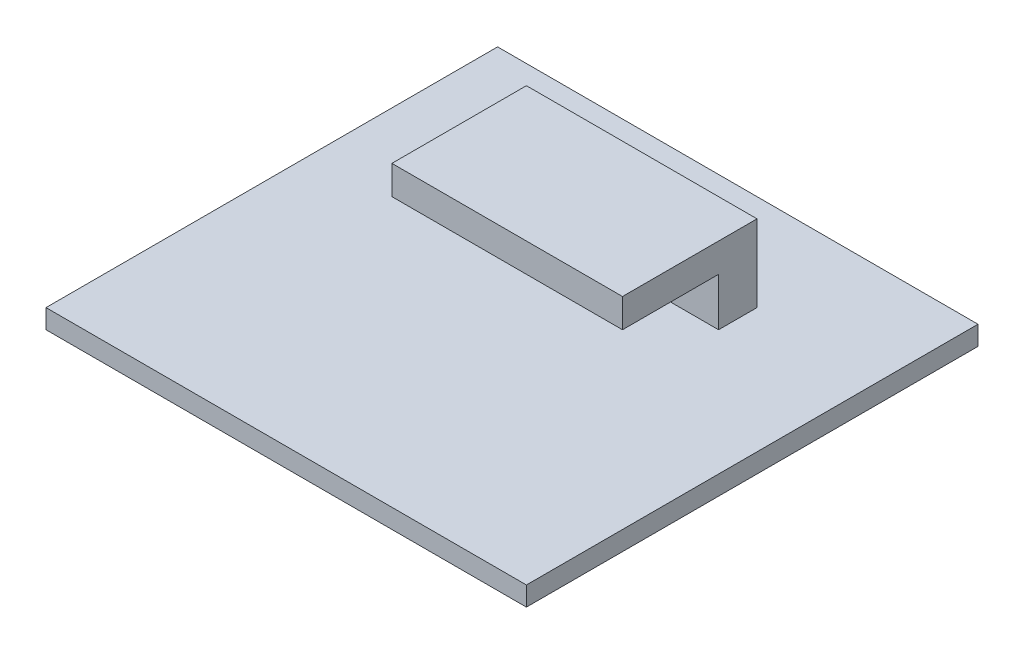
from build123d import *

# Parameters (mm, degrees)
SKETCH_1_W      = 50
SKETCH_1_H      = 47
EXTRUDE_1_DEPTH = 2
EXTRUDE_2_DEPTH = 8
SKETCH_3_W      = 24
SKETCH_3_H      = 3
EXTRUDE_3_DEPTH = 10


with BuildPart() as part:
    # Эскиз1 → Бобышка-Вытянуть1 (new body)
    with BuildSketch(Plane(origin=(0, 0, 0), x_dir=(1, 0, 0), z_dir=(0, 1, 0))):
        with Locations((25, 23.5)):
            Rectangle(SKETCH_1_W, SKETCH_1_H)
    extrude(amount=EXTRUDE_1_DEPTH)

    # Эскиз2 → Бобышка-Вытянуть2 (add)
    with BuildSketch(Plane(origin=(0, 2, 0), x_dir=(1, 0, 0), z_dir=(0, 1, 0))):
        Polygon((25, 37), (13, 37), (13, 33), (37, 33), (37, 37), align=None)
    extrude(amount=EXTRUDE_2_DEPTH)

    # Эскиз3 → Бобышка-Вытянуть3 (add)
    with BuildSketch(Plane.XY.offset(-33)):
        with Locations((25, 8.5)):
            Rectangle(SKETCH_3_W, SKETCH_3_H)
    extrude(amount=EXTRUDE_3_DEPTH)


solid = part.part
